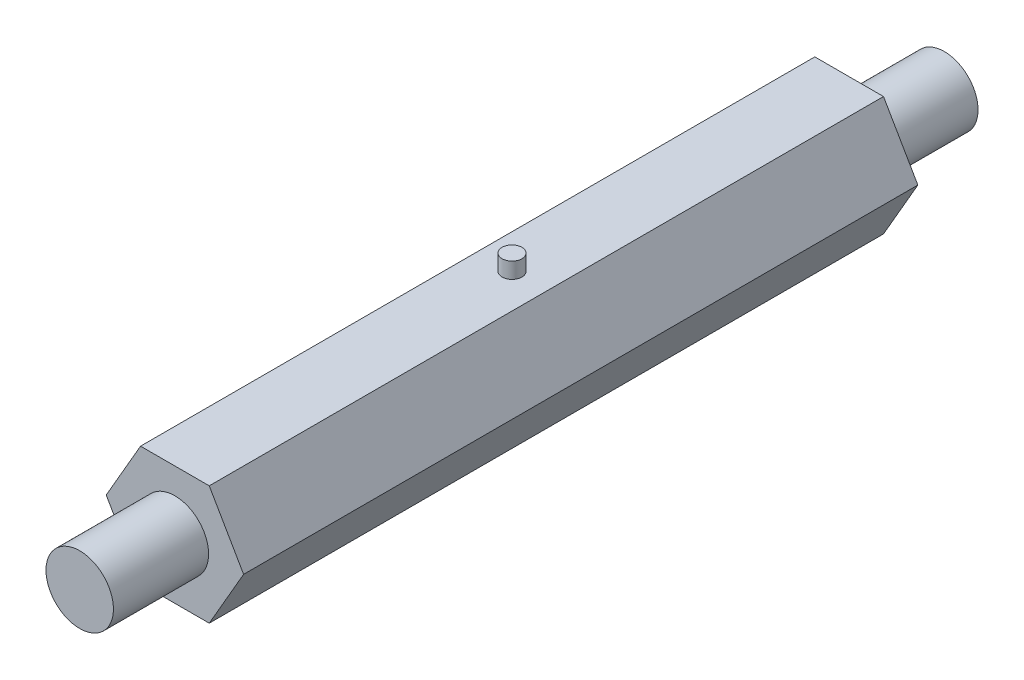
from build123d import *

# Parameters (mm, degrees)
BOSS_EXTRUDE1_DEPTH = 53.975
SKETCH2_R           = 5.3975
BOSS_EXTRUDE2_DEPTH = 15.24
SKETCH3_R           = 1.5875
BOSS_EXTRUDE3_DEPTH = 2.54


with BuildPart() as part:
    # Sketch1 → Boss-Extrude1 (new body)
    with BuildSketch(Plane.XY):
        Polygon((5.499261314, 9.525), (-5.499261314, 9.525), (-10.998522628, 0), (-5.499261314, -9.525), (5.499261314, -9.525), (10.998522628, 0), align=None)
    extrude(amount=BOSS_EXTRUDE1_DEPTH)

    # Sketch2 → Boss-Extrude2 (add)
    with BuildSketch(Plane.XY.offset(53.975)):
        with Locations(Location((0, 0, 0), (0, 0, 180))):
            Circle(SKETCH2_R)
    extrude(amount=BOSS_EXTRUDE2_DEPTH)

    # Mirror1: part across plane


with BuildPart() as part_1:
    add(part.part)
    add(part.part.mirror(Plane.XY))

    # Sketch3 → Boss-Extrude3 (add)
    with BuildSketch(Plane(origin=(0, 9.525, 0), x_dir=(1, 0, 0), z_dir=(0, 1, 0))):
        with Locations(Location((0, 0, 0), (0, 0, 90))):
            Circle(SKETCH3_R)
    extrude(amount=BOSS_EXTRUDE3_DEPTH)


solid = part_1.part
